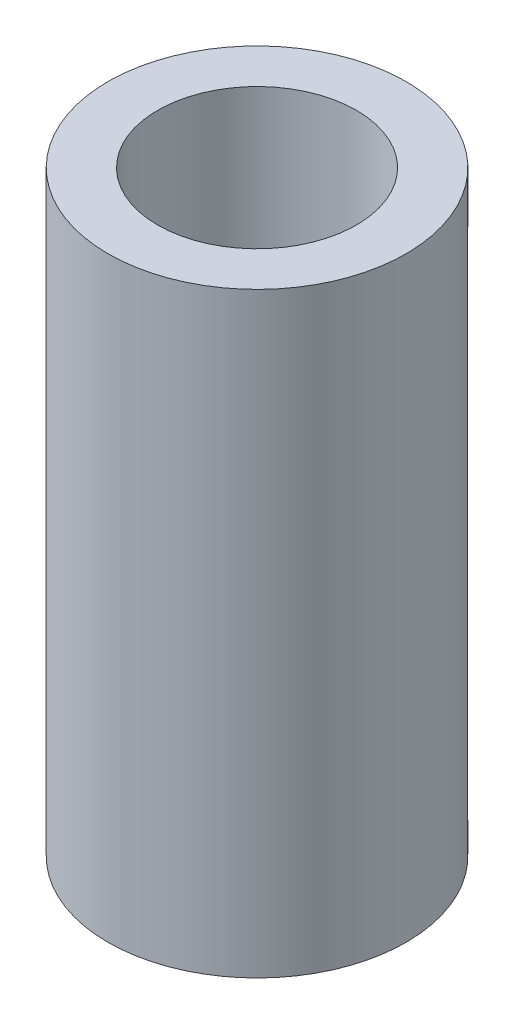
from build123d import *

# Parameters (mm, degrees)
SKETCH_1_R          = 4.5
SKETCH_1_R_2        = 3
EXTRUDE_1_DEPTH     = 18
SKETCH_2_R          = 3
CUT_EXTRUDE_1_DEPTH = 20.091883092


with BuildPart() as part:
    # 草图1 → 凸台-拉伸1 (new body)
    with BuildSketch(Plane(origin=(0, 0, 0), x_dir=(1, 0, 0), z_dir=(0, 1, 0))):
        with Locations(Location((0, 0, 0), (0, 0, 270))):
            Circle(SKETCH_1_R)
        with Locations(Location((0, 0, 0), (0, 0, 270))):
            Circle(SKETCH_1_R_2, mode=Mode.SUBTRACT)
    extrude(amount=EXTRUDE_1_DEPTH)

    # 草图2 → 切除-拉伸1 (cut, through all)
    with BuildSketch(Plane.XY):
        with Locations((0, 6)):
            Circle(SKETCH_2_R)
    extrude(amount=-CUT_EXTRUDE_1_DEPTH, mode=Mode.SUBTRACT)


solid = part.part
